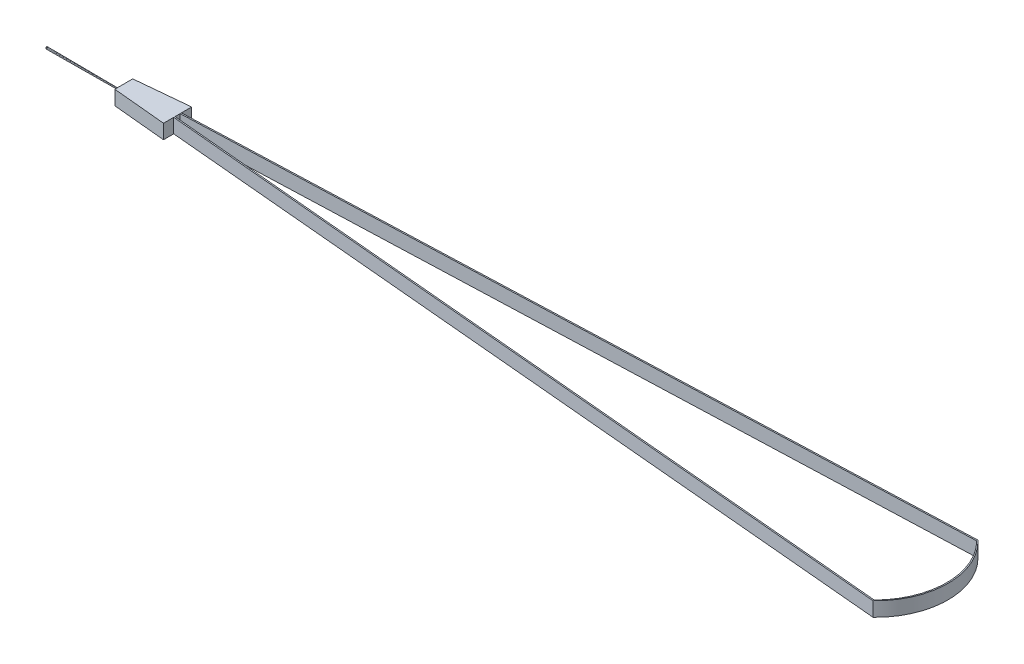
from build123d import *

# Parameters (mm, degrees)
BOSS_EXTRUDE1_DEPTH = 5.6
SKETCH2_W           = 0.5
SKETCH2_H           = 0.5
BOSS_EXTRUDE2_DEPTH = 100
CUT_EXTRUDE1_DEPTH  = 100
SKETCH4_W           = 2
SKETCH4_H           = 5.6
BOSS_EXTRUDE3_DEPTH = 300
SKETCH5_W           = 300
SKETCH5_H           = 2
CUT_EXTRUDE4_DEPTH  = 65
BOSS_EXTRUDE4_DEPTH = 5.6


with BuildPart() as part:
    # Sketch1 → Boss-Extrude1 (new body)
    with BuildSketch(Plane(origin=(0, 0, 0), x_dir=(1, 0, 0), z_dir=(0, 1, 0))):
        Polygon((-10.093548387, 6.503225806), (10.906451613, 8.503225806), (10.906451613, -2.496774194), (-10.093548387, -0.496774194), align=None)
    extrude(amount=BOSS_EXTRUDE1_DEPTH)

    # Sketch2 → Boss-Extrude2 (add)
    with BuildSketch(Plane.ZY.offset(10.093548387)):
        with Locations((-3.003225806, 2.8)):
            Rectangle(SKETCH2_W, SKETCH2_H)
    extrude(amount=BOSS_EXTRUDE2_DEPTH)

    # Sketch3 → Cut-Extrude1 (cut)
    with BuildSketch(Plane(origin=(0, 3.05, 0), x_dir=(1, 0, 0), z_dir=(0, 1, 0))):
        Polygon((-10.093548387, 3.028225806), (-10.093548387, 3.253225806), (-37.093548387, 3.253225806), align=None)
        with BuildLine():
            Line((-10.093548387, 3.003225806), (-40.093548387, 3.253225806))
            ThreePointArc((-40.093548387, 3.253225806), (-40.321412932, 3.003225806), (-40.093548387, 2.753225806))
            Line((-40.093548387, 2.753225806), (-10.093548387, 3.003225806))
        make_face()
        with BuildLine():
            ThreePointArc((-40.187314985, 2.753225806), (-40.346412932, 3.003225806), (-40.187314985, 3.253225806))
            Line((-40.187314985, 3.253225806), (-110.093548387, 3.253225806))
            Line((-110.093548387, 3.253225806), (-110.093548387, 2.753225806))
            Line((-110.093548387, 2.753225806), (-40.187314985, 2.753225806))
        make_face()
        Polygon((-10.093548387, 2.753225806), (-10.093548387, 2.978225806), (-37.093548387, 2.753225806), align=None)
    extrude(amount=-CUT_EXTRUDE1_DEPTH, mode=Mode.SUBTRACT)


with BuildPart() as cut_extrude1_piece_1:
    # of the separate pieces the step leaves, piece 1, a body of its own (cut_extrude1_pieces)
    add(part.part.solids().sort_by_distance((-10.093548387, 0, -6.503225806))[0])

    # Sketch4 → Boss-Extrude3 (add)
    with BuildSketch(Plane(origin=(10.906451613, 0, 0), x_dir=(0, 0, -1), z_dir=(1, 0, 0))):
        with Locations((3.003225806, 2.8)):
            Rectangle(SKETCH4_W, SKETCH4_H)
    extrude(amount=BOSS_EXTRUDE3_DEPTH)

    # Sketch5 → Cut-Extrude4 (cut)
    with BuildSketch(Plane(origin=(0, 5.6, 0), x_dir=(1, 0, 0), z_dir=(0, 1, 0))):
        with Locations((160.906451613, 3.003225806)):
            Rectangle(SKETCH5_W, SKETCH5_H)
    extrude(amount=-CUT_EXTRUDE4_DEPTH, mode=Mode.SUBTRACT)


with BuildPart() as cut_extrude1_piece_2:
    # of the separate pieces the step leaves, piece 2, a body of its own (cut_extrude1_pieces)
    add(part.part.solids().sort_by_distance((-40.187314985, 2.55, -2.753225806))[0])


with BuildPart() as body_3:
    # Sketch5<8> → Boss-Extrude4 (new body)
    with BuildSketch(Plane(origin=(0, 5.6, 0), x_dir=(1, 0, 0), z_dir=(0, 1, 0))):
        with BuildLine():
            Line((10.906451613, 4.503225806), (10.906451613, 4.003225806))
            Line((10.906451613, 4.003225806), (310.906451613, 15.044597432))
            ThreePointArc((310.906451613, 15.044597432), (319.19072286, -4.955402568), (310.906451613, -24.955402568))
            Line((310.906451613, -24.955402568), (10.906451613, 2.003225806))
            Line((10.906451613, 2.003225806), (10.906451613, 1.501089766))
            Line((10.906451613, 1.501089766), (310.906451613, -25.455402568))
            ThreePointArc((310.906451613, -25.455402568), (319.69072286, -4.955402568), (310.906451613, 15.544597432))
            Line((310.906451613, 15.544597432), (10.906451613, 4.503225806))
        make_face()
    extrude(amount=-BOSS_EXTRUDE4_DEPTH)


solid = Compound([cut_extrude1_piece_1.part, cut_extrude1_piece_2.part, body_3.part])
